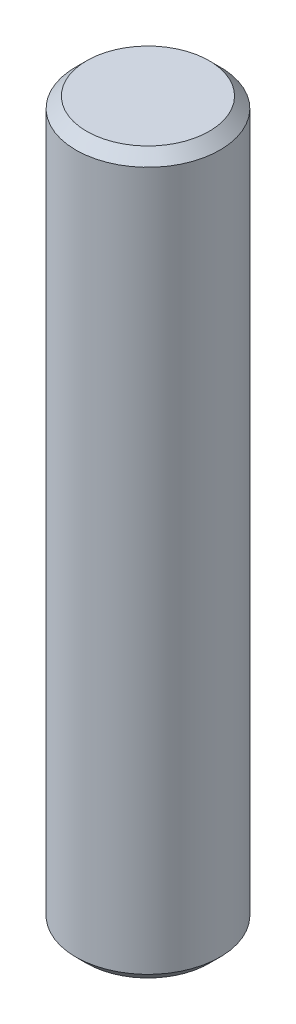
from build123d import *

# Parameters (mm, degrees)
SKETCH_1_R      = 2
EXTRUDE_1_DEPTH = 20
CHAMFER_1_SIZE  = 0.3


with BuildPart() as part:
    # 草图1 → 凸台-拉伸1 (new body)
    with BuildSketch(Plane(origin=(0, 0, 0), x_dir=(1, 0, 0), z_dir=(0, 1, 0))):
        with Locations(Location((0, 0, 0), (0, 0, 270))):
            Circle(SKETCH_1_R)
    extrude(amount=EXTRUDE_1_DEPTH)

    # 倒角1
    chamfer_1_edges = [part.edges().sort_by_distance(p)[0] for p in [
        (0, 0, -2),
        (0, 20, -2),
    ]]
    chamfer(chamfer_1_edges, length=CHAMFER_1_SIZE)


solid = part.part
